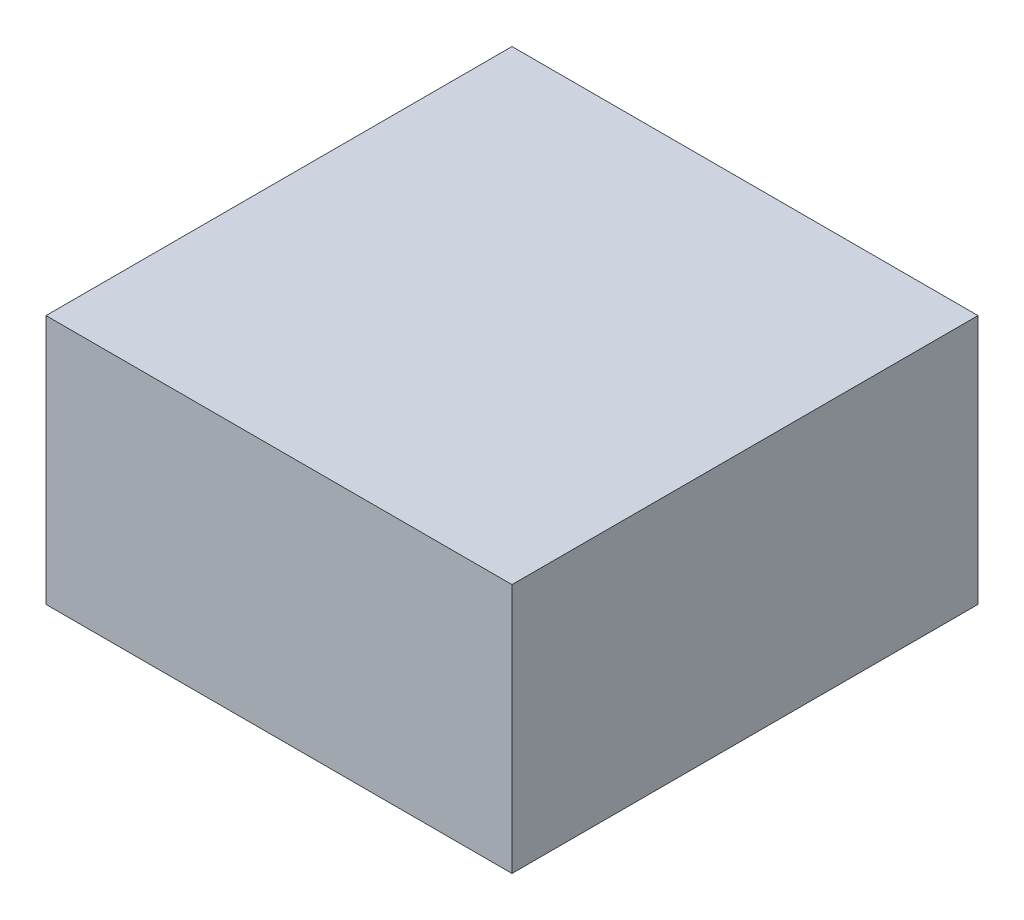
from build123d import *

# Parameters (mm, degrees)
SKETCH2_W           = 95
SKETCH2_H           = 51
BOSS_EXTRUDE1_DEPTH = 95


with BuildPart() as part:
    # Sketch2 → Boss-Extrude1 (new body)
    with BuildSketch(Plane.XY):
        with Locations((53.873801917, 10.618210863)):
            Rectangle(SKETCH2_W, SKETCH2_H)
    extrude(amount=BOSS_EXTRUDE1_DEPTH)


solid = part.part
